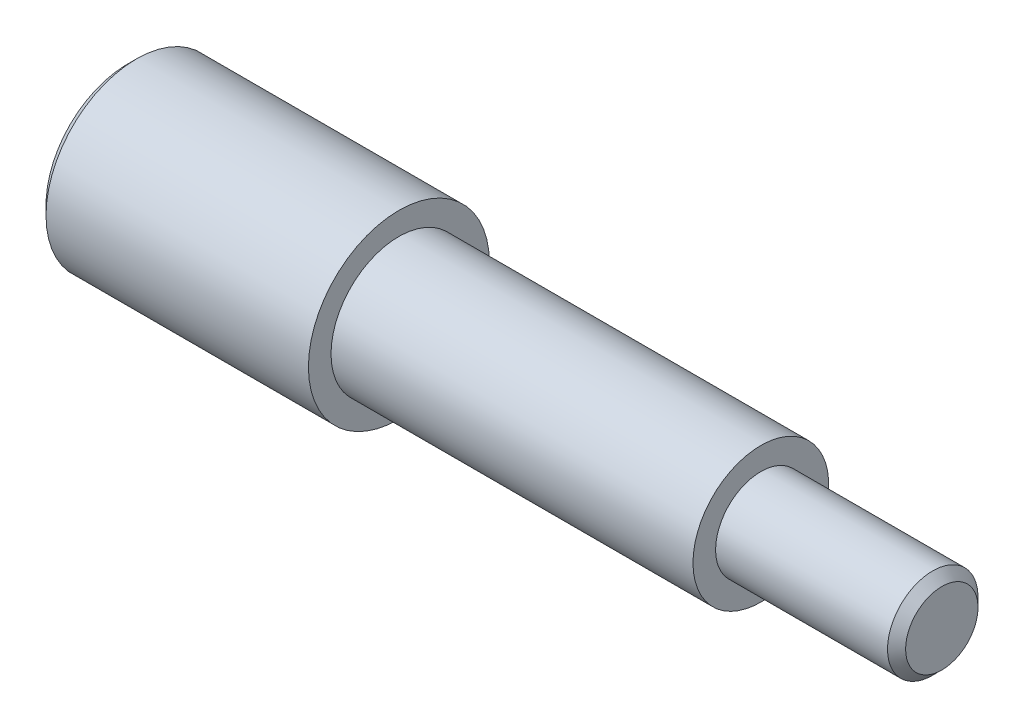
from build123d import *

# Parameters (mm, degrees)
CHAMFER1_SIZE = 1.27


with BuildPart() as part:
    # Sketch1 → Shaft (revolve)
    with BuildSketch(Plane.XY, mode=Mode.PRIVATE) as shaft_sk:
        Polygon((0, 0), (114.3, 0), (114.3, 6.35), (88.9, 6.35), (88.9, 9.525), (38.1, 9.525), (38.1, 12.7), (0, 12.7), align=None)
    revolve(shaft_sk.sketch.rotate(Axis((0, 0, 0), (1, 0, 0)), 90), axis=Axis((0, 0, 0), (1, 0, 0)))

    # Chamfer1
    chamfer1_edges = [part.edges().sort_by_distance(p)[0] for p in [
        (0, 0, -12.7),
        (114.3, 0, -6.35),
    ]]
    chamfer(chamfer1_edges, length=CHAMFER1_SIZE)


solid = part.part
